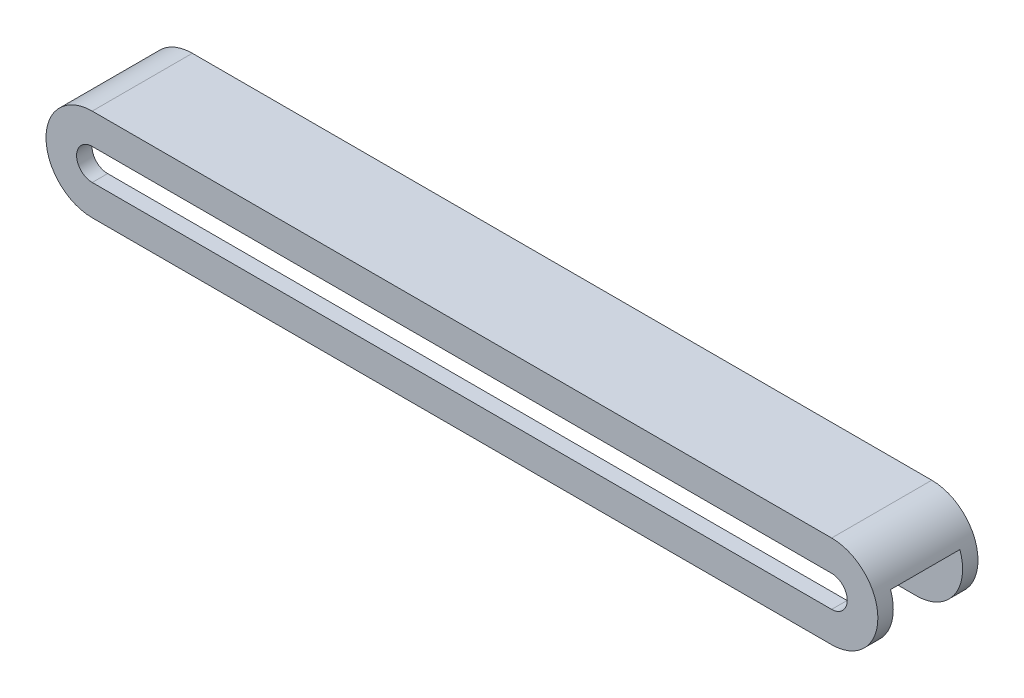
from build123d import *

# Parameters (mm, degrees)
BOSS_EXTRUDE1_DEPTH = 41.275
CUT_EXTRUDE1_REACH  = 330.685
SKETCH2_W           = 342.9
SKETCH2_H           = 28.575


with BuildPart() as part:
    # Sketch1 → Boss-Extrude1 (new body)
    with BuildSketch(Plane.XY):
        with BuildLine():
            Line((0, 19.05), (304.8, 19.05))
            ThreePointArc((304.8, 19.05), (323.85, 0), (304.8, -19.05))
            Line((304.8, -19.05), (0, -19.05))
            ThreePointArc((0, -19.05), (-19.05, 0), (0, 19.05))
        make_face()
        with BuildLine():
            Line((0, 6.43255), (304.8, 6.43255))
            ThreePointArc((304.8, 6.43255), (311.23255, 0), (304.8, -6.43255))
            Line((304.8, -6.43255), (0, -6.43255))
            ThreePointArc((0, -6.43255), (-6.43255, 0), (0, 6.43255))
        make_face(mode=Mode.SUBTRACT)
    extrude(amount=BOSS_EXTRUDE1_DEPTH)

    # Cut-Extrude1: up to this face of the body (flat: up to its plane)
    cut_extrude1_end = Plane(part.part.faces().sort_by_distance((152.4, 6.43255, 20.6375))[0])
    # Sketch2 → Cut-Extrude1 (cut, up to the picked face)
    with BuildSketch(Plane.XZ.offset(19.05), mode=Mode.PRIVATE) as cut_extrude1_sk1:
        with Locations((152.4, 20.6375)):
            Rectangle(SKETCH2_W, SKETCH2_H)
    cut_extrude1_tool1 = split(extrude(cut_extrude1_sk1.sketch, amount=-CUT_EXTRUDE1_REACH, mode=Mode.PRIVATE), bisect_by=cut_extrude1_end, keep=Keep.BOTH, mode=Mode.PRIVATE)
    add(cut_extrude1_tool1.solids().sort_by(Axis((152.4, -19.05, 20.6375), (0, 1, 0)))[0], mode=Mode.SUBTRACT)


solid = part.part
